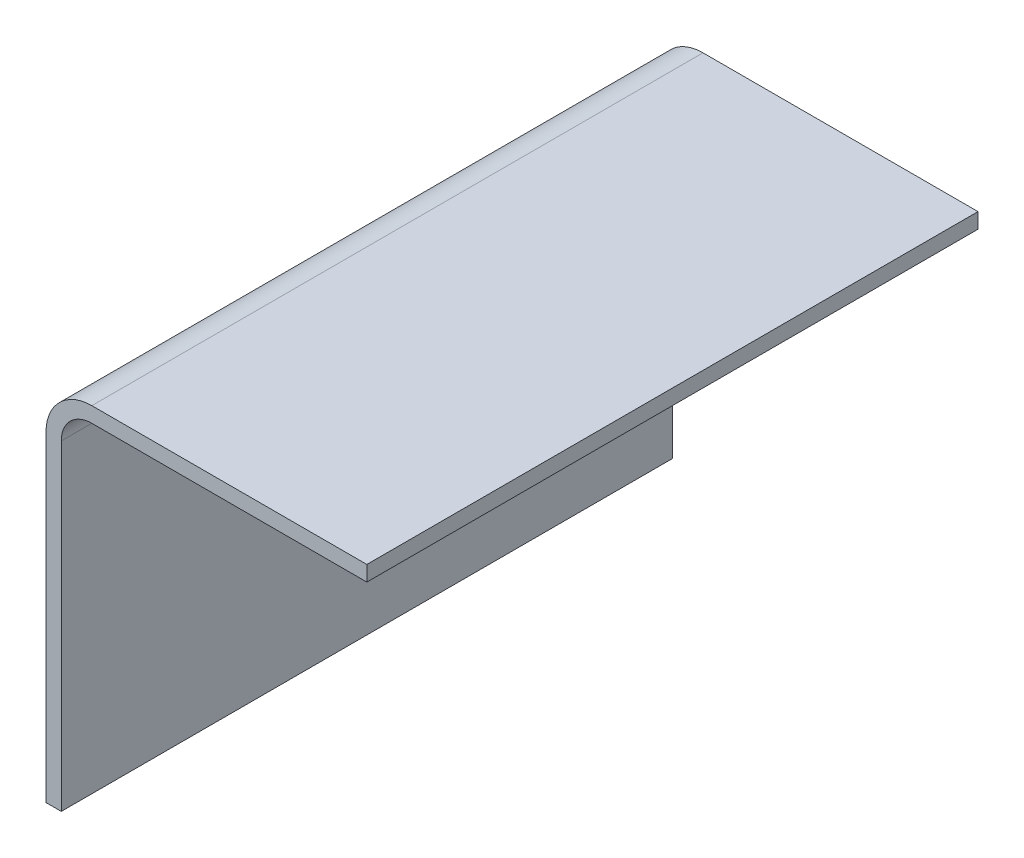
from build123d import *

# Parameters (mm, degrees)
EXTRUDE_1_DEPTH = 200


with BuildPart() as part:
    # 草图2 → 凸台-拉伸1 (new body)
    with BuildSketch(Plane.XY):
        with BuildLine():
            Line((0, 10), (0, 115))
            ThreePointArc((0, 115), (2.928932188, 122.071067812), (10, 125))
            Line((10, 125), (90, 125))
            Line((90, 125), (100, 125))
            Line((100, 125), (100, 130))
            Line((100, 130), (10, 130))
            ThreePointArc((10, 130), (-0.606601718, 125.606601718), (-5, 115))
            Line((-5, 115), (-5, 20))
            Line((-5, 20), (-5, 10))
            Line((-5, 10), (0, 10))
        make_face()
    extrude(amount=EXTRUDE_1_DEPTH)


solid = part.part
